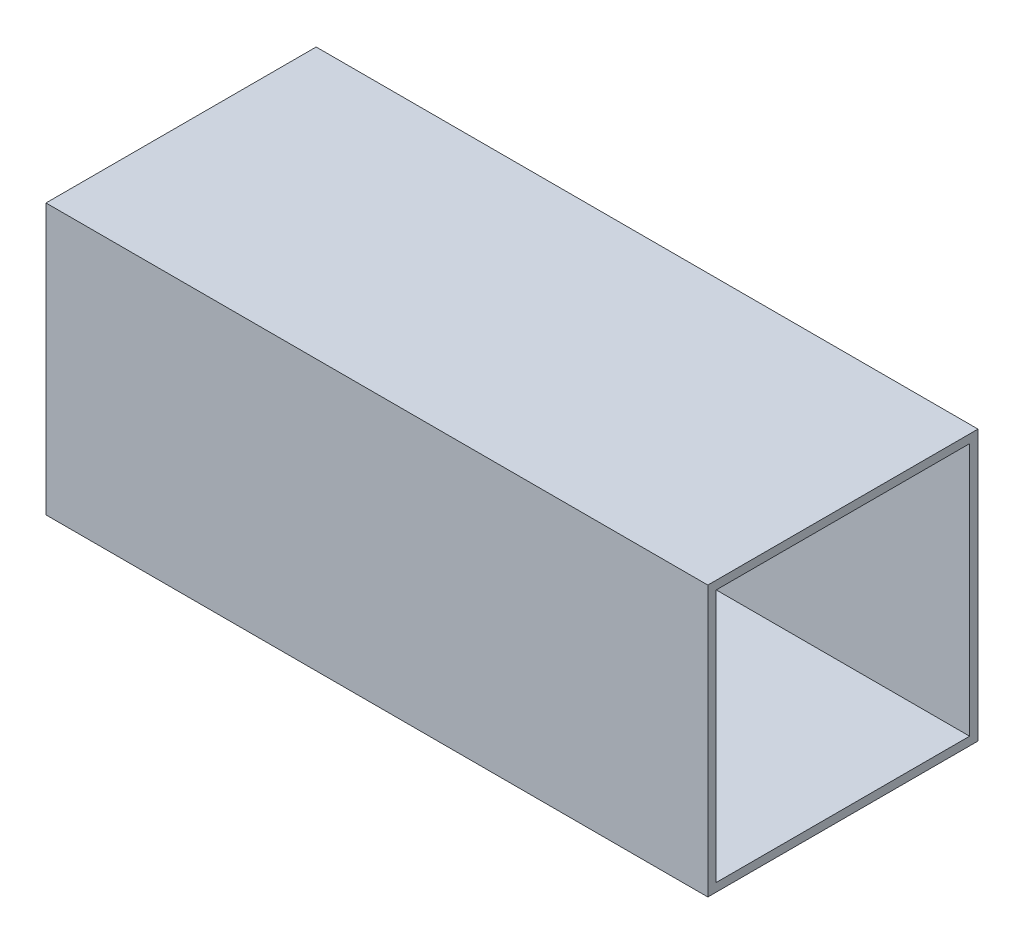
from build123d import *

# Parameters (mm, degrees)
SKETCH11_W                                 = 28.575
SKETCH11_H                                 = 28.575
SKETCH11_W_2                               = 26.797
SKETCH11_H_2                               = 26.797
AL_TUBE_SQUARE_1_125_SQ_X_035_WALL_3_DEPTH = 70


with BuildPart() as part:
    # Sketch11 → Al tube (square) 1.125 SQ X .035 WALL(3) (new body)
    with BuildSketch(Plane.YZ):
        Rectangle(SKETCH11_W, SKETCH11_H)
        Rectangle(SKETCH11_W_2, SKETCH11_H_2, mode=Mode.SUBTRACT)
    extrude(amount=AL_TUBE_SQUARE_1_125_SQ_X_035_WALL_3_DEPTH)


solid = part.part
